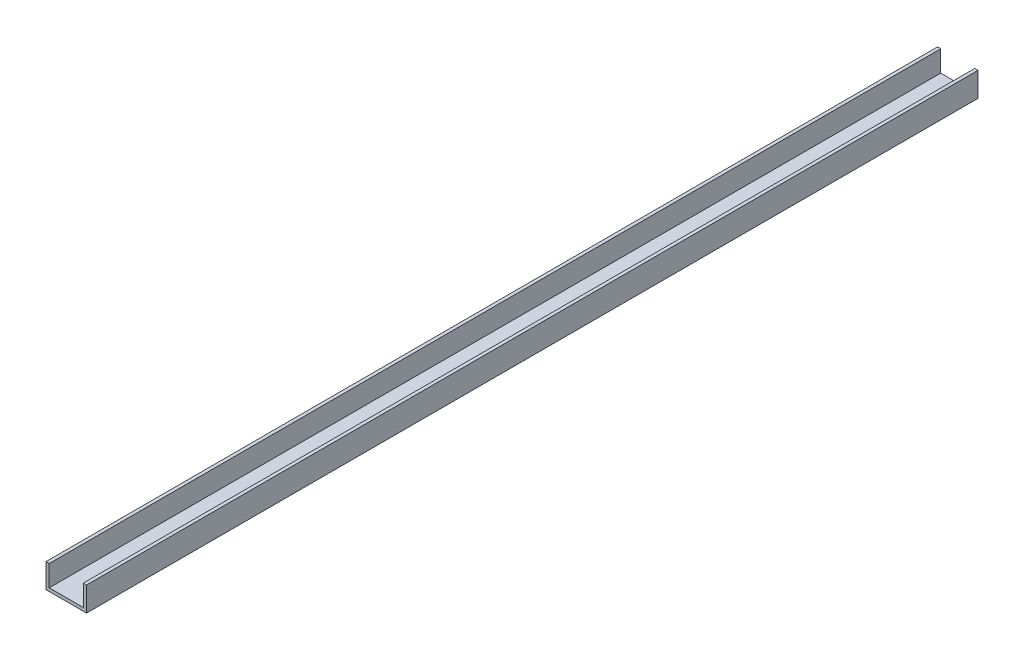
from build123d import *

# Parameters (mm, degrees)
BOSS_EXTRU_1_DEPTH = 550


with BuildPart() as part:
    # Esquisse1 → Boss.-Extru.1 (new body)
    with BuildSketch(Plane.XY):
        Polygon((-12.5, 0), (12.5, 0), (12.5, 15), (10.5, 15), (10.5, 2), (-10.5, 2), (-10.5, 15), (-12.5, 15), align=None)
    extrude(amount=BOSS_EXTRU_1_DEPTH)


solid = part.part
